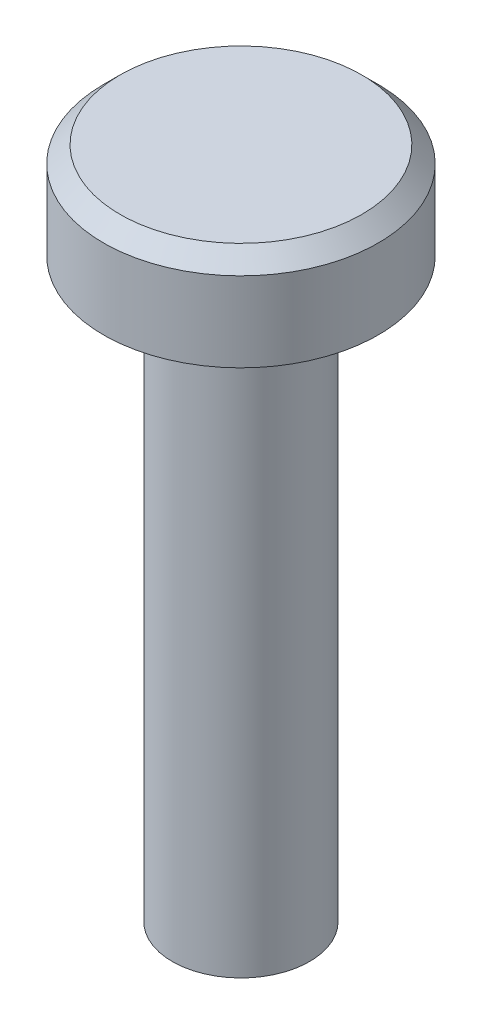
from build123d import *


with BuildPart() as part:
    # Sketch1 → Revolve1 (revolve)
    with BuildSketch(Plane.XY, mode=Mode.PRIVATE) as revolve1_sk:
        Polygon((0, 0), (4.4, 0), (5, -0.6), (5, -3.5), (2.5, -3.5), (2.5, -24.5), (0, -24.5), align=None)
    revolve(revolve1_sk.sketch.rotate(Axis((0, 0, 0), (0, -1, 0)), 180), axis=Axis((0, 0, 0), (0, -1, 0)))


solid = part.part
